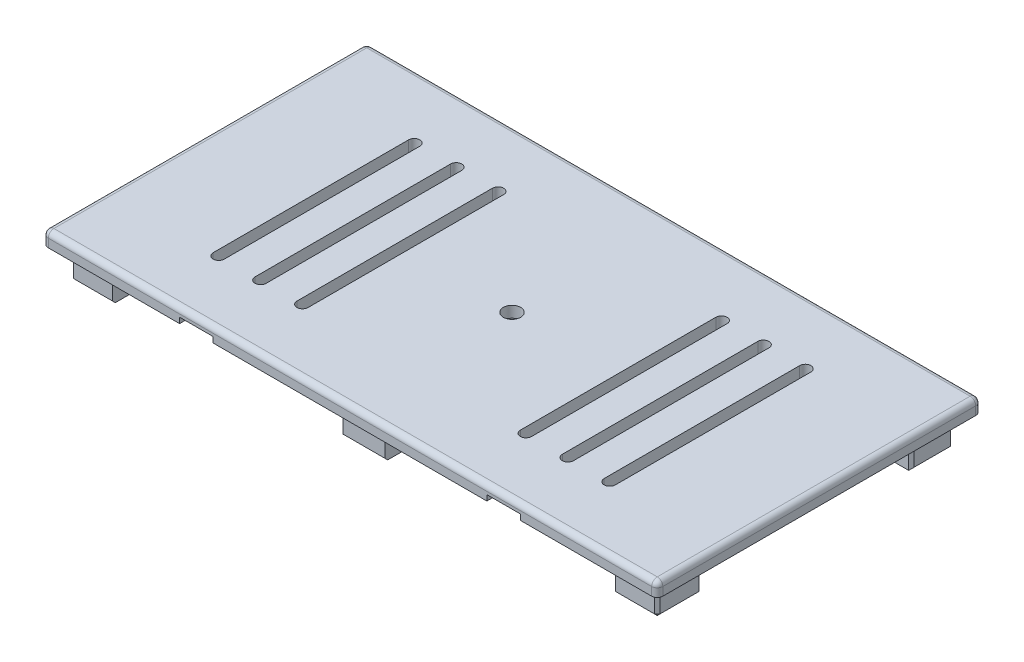
from build123d import *

# Parameters (mm, degrees)
SKETCH1_W           = 110
SKETCH1_H           = 58
BOSS_EXTRUDE1_DEPTH = 2.5
SKETCH2_W           = 105
SKETCH2_H           = 53
BOSS_EXTRUDE2_DEPTH = 1.5
SKETCH3_W           = 7.5
SKETCH3_H           = 3
BOSS_EXTRUDE3_DEPTH = 4
FILLET1_R           = 1
SKETCH4_W           = 6
SKETCH4_H           = 2.5
CUT_EXTRUDE1_DEPTH  = 1
FILLET2_R           = 1
CHAMFER1_SIZE       = 0.5
CUT_EXTRUDE2_DEPTH  = 125.611395948
FILLET3_R           = 1
SKETCH6_R           = 1.55
CUT_EXTRUDE3_DEPTH  = 125.611395948
SKETCH7_R           = 2.05
CUT_EXTRUDE4_DEPTH  = 2


with BuildPart() as part:
    # Sketch1 → Boss-Extrude1 (new body)
    with BuildSketch(Plane(origin=(0, 0, 0), x_dir=(1, 0, 0), z_dir=(0, 1, 0))):
        with Locations((55, 29)):
            Rectangle(SKETCH1_W, SKETCH1_H)
    extrude(amount=BOSS_EXTRUDE1_DEPTH)

    # Sketch2 → Boss-Extrude2 (add)
    with BuildSketch(Plane.XZ):
        with Locations((55, -29)):
            Rectangle(SKETCH2_W, SKETCH2_H)
    extrude(amount=BOSS_EXTRUDE2_DEPTH)

    # Sketch3 → Boss-Extrude3 (add)
    with BuildSketch(Plane.XZ.offset(1.5)):
        with Locations((55, -4)):
            Rectangle(SKETCH3_W, SKETCH3_H)
        Polygon((2.5, -2.5), (10, -2.5), (10, -5.5), (5.5, -5.5), (5.5, -10), (2.5, -10), align=None)
        Polygon((107.5, -2.5), (107.5, -10), (104.5, -10), (104.5, -5.5), (100, -5.5), (100, -2.5), align=None)
        Polygon((107.5, -55.5), (100, -55.5), (100, -52.5), (104.5, -52.5), (104.5, -48), (107.5, -48), align=None)
        with Locations((55, -54)):
            Rectangle(SKETCH3_W, SKETCH3_H)
        Polygon((2.5, -55.5), (2.5, -48), (5.5, -48), (5.5, -52.5), (10, -52.5), (10, -55.5), align=None)
    extrude(amount=BOSS_EXTRUDE3_DEPTH)

    # Fillet1
    fillet1_edges = [part.edges().sort_by_distance(p)[0] for p in [
        (104.5, -3.5, -52.5),
        (5.5, -3.5, -5.5),
        (104.5, -3.5, -5.5),
        (5.5, -3.5, -52.5),
    ]]
    fillet(fillet1_edges, radius=FILLET1_R)

    # Sketch4 → Cut-Extrude1 (cut)
    with BuildSketch(Plane.XZ):
        with Locations((27.5, -1.25)):
            Rectangle(SKETCH4_W, SKETCH4_H)
        with Locations((82.5, -1.25)):
            Rectangle(SKETCH4_W, SKETCH4_H)
        with Locations((82.5, -56.75)):
            Rectangle(SKETCH4_W, SKETCH4_H)
        with Locations((27.5, -56.75)):
            Rectangle(SKETCH4_W, SKETCH4_H)
    extrude(amount=-CUT_EXTRUDE1_DEPTH, mode=Mode.SUBTRACT)

    # Fillet2
    fillet2_edges = [part.edges().sort_by_distance(p)[0] for p in [
        (0, 1.25, -58),
        (110, 1.25, -58),
        (110, 1.25, 0),
        (0, 1.25, 0),
    ]]
    fillet(fillet2_edges, radius=FILLET2_R)

    # Chamfer1
    chamfer1_edges = [part.edges().sort_by_distance(p)[0] for p in [
        (2.5, -2.75, -2.5),
        (2.5, -2.75, -55.5),
        (107.5, -2.75, -55.5),
        (107.5, -2.75, -2.5),
        (107.5, -3.5, -48),
        (100, -3.5, -55.5),
        (107.5, -5.5, -51.75),
        (103.75, -5.5, -55.5),
        (2.5, -5.5, -6.25),
        (6.25, -5.5, -2.5),
        (55, -5.5, -2.5),
        (103.75, -5.5, -2.5),
        (107.5, -5.5, -6.25),
        (55, -5.5, -55.5),
        (6.25, -5.5, -55.5),
        (2.5, -5.5, -51.75),
    ]]
    chamfer(chamfer1_edges, length=CHAMFER1_SIZE)

    # Sketch5 → Cut-Extrude2 (cut, through all)
    with BuildSketch(Plane(origin=(0, 2.5, 0), x_dir=(1, 0, 0), z_dir=(0, 1, 0))):
        with BuildLine():
            Line((28.5, 46.5), (28.5, 11.5))
            ThreePointArc((28.5, 11.5), (27.5, 10.5), (26.5, 11.5))
            Line((26.5, 11.5), (26.5, 46.5))
            ThreePointArc((26.5, 46.5), (27.5, 47.5), (28.5, 46.5))
        make_face()
        with BuildLine():
            Line((34, 46.5), (34, 11.5))
            ThreePointArc((34, 11.5), (35, 10.5), (36, 11.5))
            Line((36, 11.5), (36, 46.5))
            ThreePointArc((36, 46.5), (35, 47.5), (34, 46.5))
        make_face()
        with BuildLine():
            Line((21, 46.5), (21, 11.5))
            ThreePointArc((21, 11.5), (20, 10.5), (19, 11.5))
            Line((19, 11.5), (19, 46.5))
            ThreePointArc((19, 46.5), (20, 47.5), (21, 46.5))
        make_face()
        with BuildLine():
            Line((89, 46.5), (89, 11.5))
            ThreePointArc((89, 11.5), (90, 10.5), (91, 11.5))
            Line((91, 11.5), (91, 46.5))
            ThreePointArc((91, 46.5), (90, 47.5), (89, 46.5))
        make_face()
        with BuildLine():
            Line((74, 46.5), (74, 11.5))
            ThreePointArc((74, 11.5), (75, 10.5), (76, 11.5))
            Line((76, 11.5), (76, 46.5))
            ThreePointArc((76, 46.5), (75, 47.5), (74, 46.5))
        make_face()
        with BuildLine():
            Line((81.5, 46.5), (81.5, 11.5))
            ThreePointArc((81.5, 11.5), (82.5, 10.5), (83.5, 11.5))
            Line((83.5, 11.5), (83.5, 46.5))
            ThreePointArc((83.5, 46.5), (82.5, 47.5), (81.5, 46.5))
        make_face()
    extrude(amount=-CUT_EXTRUDE2_DEPTH, mode=Mode.SUBTRACT)

    # Fillet3
    fillet3_edges = [part.edges().sort_by_distance(p)[0] for p in [
        (0, 2.5, -29),
        (55, 2.5, -58),
        (55, 2.5, 0),
        (110, 2.5, -29),
        (109.707106781, 2.5, -0.292893219),
        (109.707106781, 2.5, -57.707106781),
        (0.292893219, 2.5, -0.292893219),
        (0.292893219, 2.5, -57.707106781),
    ]]
    fillet(fillet3_edges, radius=FILLET3_R)

    # Sketch6 → Cut-Extrude3 (cut, through all)
    with BuildSketch(Plane(origin=(0, 2.5, 0), x_dir=(1, 0, 0), z_dir=(0, 1, 0))):
        with Locations(Location((55, 29, 0), (0, 0, 270))):
            Circle(SKETCH6_R)
    extrude(amount=-CUT_EXTRUDE3_DEPTH, mode=Mode.SUBTRACT)

    # Sketch7 → Cut-Extrude4 (cut)
    with BuildSketch(Plane.XZ.offset(1.5)):
        with Locations(Location((55, -29, 0), (0, 0, 270))):
            Circle(SKETCH7_R)
    extrude(amount=-CUT_EXTRUDE4_DEPTH, mode=Mode.SUBTRACT)


solid = part.part
